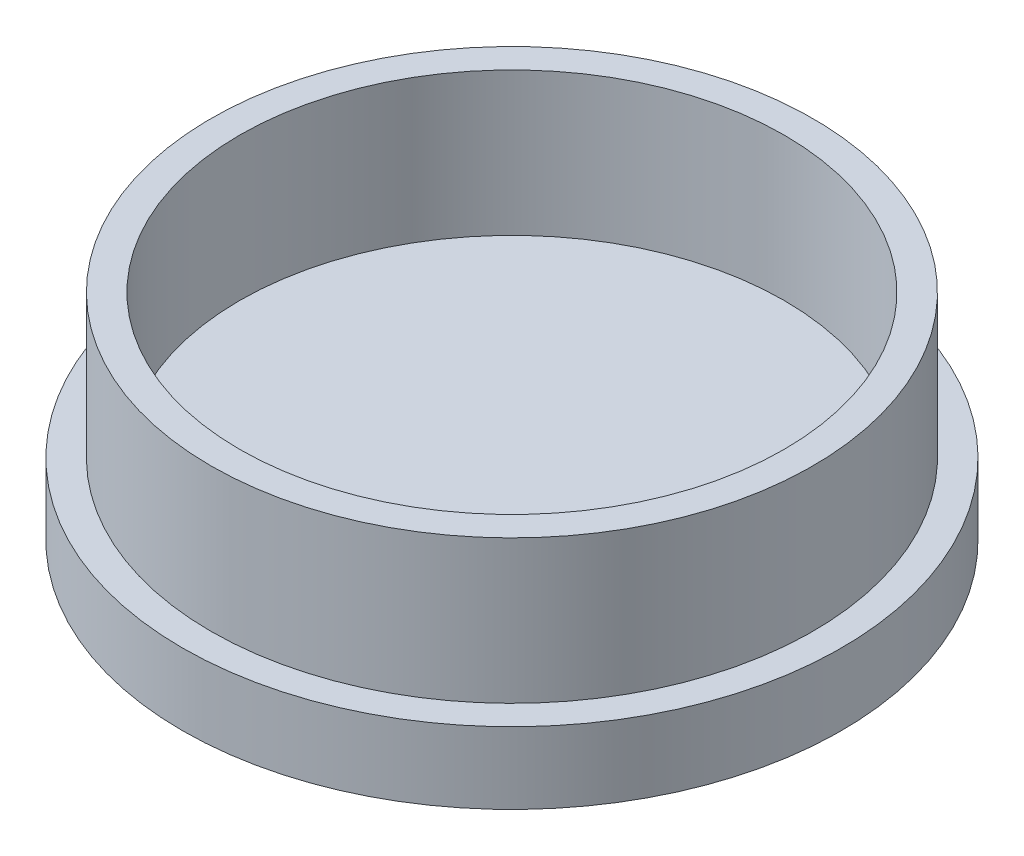
from build123d import *

# Parameters (mm, degrees)
SKETCH_1_R      = 23
EXTRUDE_1_DEPTH = 5
SKETCH_3_R      = 21
SKETCH_3_R_2    = 19
EXTRUDE_2_DEPTH = 10


with BuildPart() as part:
    # Эскиз1 → Бобышка-Вытянуть1 (new body)
    with BuildSketch(Plane(origin=(0, 0, 0), x_dir=(1, 0, 0), z_dir=(0, 1, 0))):
        with Locations(Location((0, 0, 0), (0, 0, 270))):
            Circle(SKETCH_1_R)
    extrude(amount=EXTRUDE_1_DEPTH)

    # Эскиз3 → Бобышка-Вытянуть2 (add)
    with BuildSketch(Plane(origin=(0, 5, 0), x_dir=(1, 0, 0), z_dir=(0, 1, 0))):
        with Locations(Location((0, 0, 0), (0, 0, 270))):
            Circle(SKETCH_3_R)
        with Locations(Location((0, 0, 0), (0, 0, 270))):
            Circle(SKETCH_3_R_2, mode=Mode.SUBTRACT)
    extrude(amount=EXTRUDE_2_DEPTH)


solid = part.part
